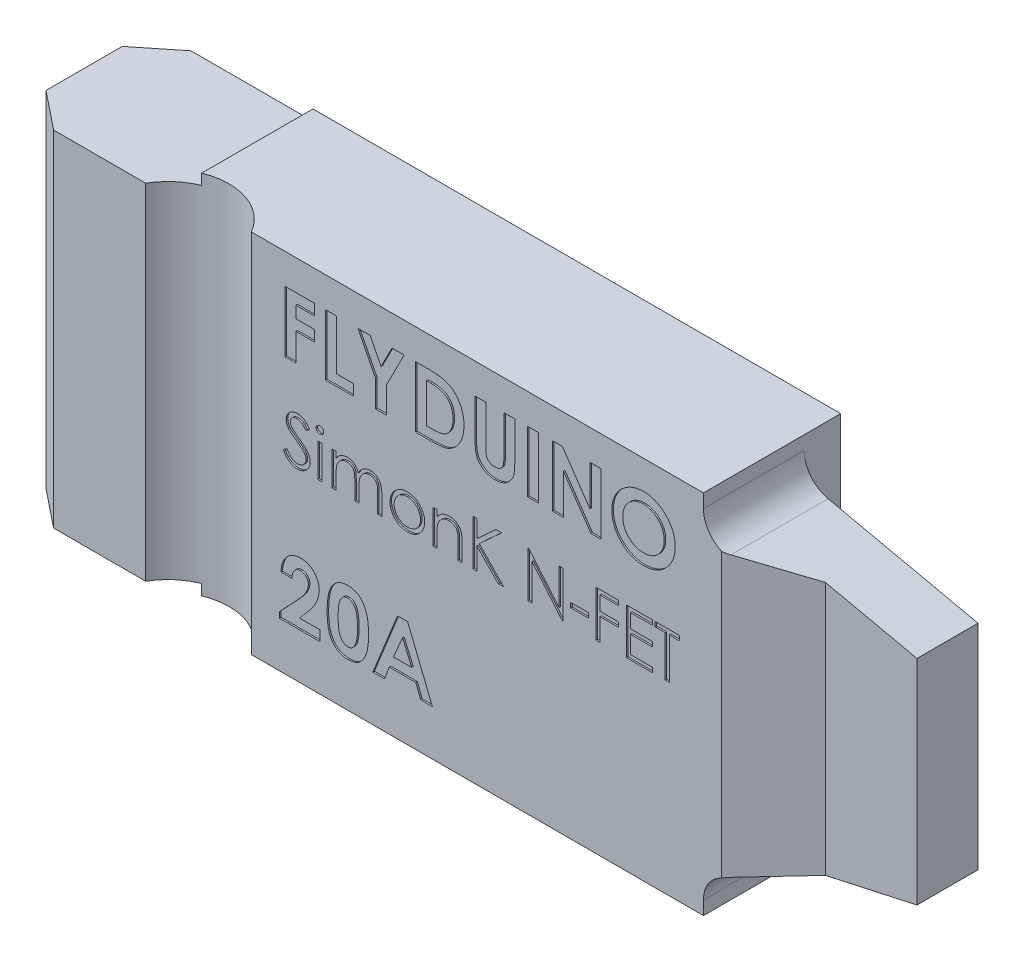
from build123d import *

# Parameters (mm, degrees)
BOSS_EXTRUDE1_DEPTH = 9
SKETCH18_W          = 11.4
SKETCH18_H          = 2.4
CUT_EXTRUDE2_DEPTH  = 100
SKETCH26_W          = 0.717948718
SKETCH26_H          = 4
CUT_EXTRUDE3_DEPTH  = 0.1
SKETCH27_W          = 0.26923077
SKETCH27_H          = 2.192307692
SKETCH27_W_2        = 1.153846154
SKETCH27_H_2        = 0.307692308
CUT_EXTRUDE4_DEPTH  = 0.1


with BuildPart() as part:
    # Sketch1 → Boss-Extrude1 (new body)
    with BuildSketch(Plane.XY):
        with BuildLine():
            Line((-17.3, 12), (17.3, 12))
            Line((17.3, 12), (17.3, 11.108930525))
            ThreePointArc((17.3, 11.108930525), (17.741662479, 9.855302122), (18.871584172, 9.155354348))
            Line((18.871584172, 9.155354348), (28.7, 7))
            Line((28.7, 7), (28.7, -7))
            Line((28.7, -7), (18.871584172, -9.155354348))
            ThreePointArc((18.871584172, -9.155354348), (17.741662479, -9.855302122), (17.3, -11.108930525))
            Line((17.3, -11.108930525), (17.3, -12))
            Line((17.3, -12), (-17.3, -12))
            Line((-17.3, -12), (-17.3, -11.3))
            Line((-17.3, -11.3), (-27.8, -11.3))
            Line((-27.8, -11.3), (-27.8, 11.3))
            Line((-27.8, 11.3), (-17.3, 11.3))
            Line((-17.3, 11.3), (-17.3, 12))
        make_face()
    extrude(amount=BOSS_EXTRUDE1_DEPTH)

    # Sketch18 → Cut-Extrude2 (cut, symmetric)
    with BuildSketch(Plane(origin=(0, 0, 0), x_dir=(1, 0, 0), z_dir=(0, 1, 0))):
        with Locations((23, -1.2)):
            Rectangle(SKETCH18_W, SKETCH18_H)
        Polygon((28.7, -6.4), (22.7, -6.4), (18.5, -9), (28.7, -9), align=None)
        with BuildLine():
            Line((-19.264101615, -9), (-12.335898385, -9))
            ThreePointArc((-12.335898385, -9), (-15.8, -7), (-19.264101615, -9))
        make_face()
        Polygon((-27.8, -7), (-25.3, -9), (-27.8, -9), align=None)
        Polygon((-27.8, -2), (-25.3, 0), (-27.8, 0), align=None)
    extrude(amount=CUT_EXTRUDE2_DEPTH, both=True, mode=Mode.SUBTRACT)

    # Sketch26 → Cut-Extrude3 (cut)
    # profile 1 of 11: a face of its own
    with BuildSketch(Plane.XY.offset(9)):
        Polygon((-10.141536209, 10.015810278), (-8.192818261, 10.015810278), (-8.192818261, 9.29786156), (-9.423587492, 9.29786156), (-9.423587492, 8.528630791), (-8.192818261, 8.528630791), (-8.192818261, 7.810682073), (-9.423587492, 7.810682073), (-9.423587492, 6.015810278), (-10.141536209, 6.015810278), align=None)
    # profile 2 of 11: a face of its own
    with BuildSketch(Plane.XY.offset(9)):
        Polygon((-7.474869543, 10.015810278), (-6.756920825, 10.015810278), (-6.756920825, 6.733758996), (-5.628715697, 6.733758996), (-5.628715697, 6.015810278), (-7.474869543, 6.015810278), align=None)
    # profile 3 of 11: a face of its own
    with BuildSketch(Plane.XY.offset(9)):
        Polygon((-5.346664415, 10.015810278), (-4.547786209, 10.015810278), (-3.833843902, 8.612765407), (-3.119901594, 10.015810278), (-2.321023389, 10.015810278), (-3.474869543, 7.748182073), (-3.474869543, 6.015810278), (-4.192818261, 6.015810278), (-4.192818261, 7.748182073), align=None)
    # profile 4 of 11: a face of its own
    with BuildSketch(Plane.XY.offset(9)):
        with BuildLine():
            Line((-1.577433645, 10.015810278), (-0.672786209, 10.015810278))
            add(Edge.make_bspline(
                [(-0.672786209, 10.015810278), (-0.602258537, 10.015317266), (-0.465927747, 10.014364267), (-0.268411405, 10.003626261), (-0.084746341, 9.987111971), (0.085185839, 9.964393572), (0.241036747, 9.93433091), (0.382605415, 9.896623191), (0.510366982, 9.853095903), (0.625722327, 9.801877216), (0.731030662, 9.742161314), (0.831024287, 9.675642593), (0.925506867, 9.599884278), (1.015804316, 9.516347899), (1.100751325, 9.423505182), (1.181762567, 9.32289394), (1.256854518, 9.21305517), (1.328297048, 9.09662246), (1.392907309, 8.97310238), (1.449262792, 8.843546306), (1.496472123, 8.70878798), (1.534832149, 8.568683785), (1.565409517, 8.423698823), (1.586803885, 8.27354053), (1.600030096, 8.118347926), (1.601371785, 8.013166279), (1.602053534, 7.959720535)],
                knots=[0, 0, 0, 0, 1.44355588, 2.790409838, 4.047694926, 5.217575253, 6.298404546, 7.294384826, 8.214239204, 9.058592145, 9.873746385, 10.689560431, 11.514393297, 12.350027578, 13.205127629, 14.088021785, 14.991911688, 15.926770944, 16.882954281, 17.842803888, 18.816321264, 19.80318086, 20.814351908, 21.847355356, 22.906180909, 24, 24, 24, 24], degree=3))
            add(Edge.make_bspline(
                [(1.602053534, 7.959720535), (1.600268346, 7.884305111), (1.596754098, 7.735845436), (1.567152037, 7.517982572), (1.51927548, 7.309139289), (1.451956694, 7.110949237), (1.368499419, 6.92517733), (1.26880036, 6.755099578), (1.154321335, 6.60162887), (1.026396033, 6.465529366), (0.887884087, 6.348549997), (0.743942243, 6.248365729), (0.593168247, 6.169362073), (0.460315286, 6.119261942), (0.345115193, 6.088103994), (0.243970759, 6.069689347), (0.129081001, 6.052802005), (-0.000625327, 6.039751831), (-0.144579231, 6.028114282), (-0.303354515, 6.021790891), (-0.476437108, 6.016537092), (-0.596659334, 6.016058898), (-0.659164415, 6.015810278)],
                knots=[0, 0, 0, 0, 1.315458931, 2.589557908, 3.828601765, 5.048913369, 6.235739168, 7.376350998, 8.481830359, 9.569842114, 10.627874879, 11.640079404, 12.624025415, 13.590060155, 14.111227486, 14.704434459, 15.382649715, 16.137166398, 16.978595427, 17.902333227, 18.909396075, 20, 20, 20, 20], degree=3))
            Line((-0.659164415, 6.015810278), (-1.577433645, 6.015810278))
            Line((-1.577433645, 6.015810278), (-1.577433645, 10.015810278))
        make_face()
        with BuildLine():
            Line((-0.859484927, 9.29786156), (-0.859484927, 6.733758996))
            Line((-0.859484927, 6.733758996), (-0.484484927, 6.733758996))
            add(Edge.make_bspline(
                [(-0.484484927, 6.733758996), (-0.439865687, 6.733840757), (-0.354048032, 6.733998011), (-0.230146766, 6.741488129), (-0.11556951, 6.749006143), (-0.01063167, 6.763275584), (0.085430459, 6.779170737), (0.171297236, 6.80129102), (0.248738748, 6.824526502), (0.316809061, 6.854108152), (0.379155922, 6.887404267), (0.436881994, 6.926414526), (0.492603815, 6.969733948), (0.545279621, 7.018636617), (0.595108778, 7.072474972), (0.641796464, 7.131526416), (0.685965837, 7.195610783), (0.726483152, 7.265066903), (0.763508092, 7.339161302), (0.796353362, 7.41717627), (0.823586938, 7.499761502), (0.846221819, 7.586143901), (0.862397008, 7.677075524), (0.875778892, 7.771882853), (0.882677643, 7.870941508), (0.883624453, 7.938344327), (0.884104816, 7.972541048)],
                knots=[0, 0, 0, 0, 1.50275155, 2.890291501, 4.180787663, 5.369391935, 6.45668281, 7.458360028, 8.354766181, 9.177074746, 9.954075863, 10.732690366, 11.5210699, 12.329727389, 13.151100085, 13.990027547, 14.863562427, 15.770965086, 16.696477834, 17.652329173, 18.619756807, 19.62365428, 20.657822005, 21.729286259, 22.847956731, 24, 24, 24, 24], degree=3))
            add(Edge.make_bspline(
                [(0.884104816, 7.972541048), (0.883148096, 8.02494429), (0.881282567, 8.127126551), (0.863291802, 8.275957246), (0.834006269, 8.41610364), (0.792218635, 8.547045614), (0.739544027, 8.669151183), (0.673609477, 8.781385854), (0.597252553, 8.885635016), (0.536871581, 8.946790919), (0.50670097, 8.97734874)],
                knots=[0, 0, 0, 0, 1.13821349, 2.219428113, 3.251817212, 4.244760574, 5.201143372, 6.134805572, 7.068016741, 8, 8, 8, 8], degree=3))
            add(Edge.make_bspline(
                [(0.50670097, 8.97734874), (0.476949891, 9.003388135), (0.416186681, 9.05657065), (0.309506452, 9.120296904), (0.191950364, 9.176286664), (0.060829087, 9.220680299), (-0.08259015, 9.255788679), (-0.239161555, 9.28000207), (-0.408046654, 9.295561338), (-0.525046316, 9.297078393), (-0.585446466, 9.29786156)],
                knots=[0, 0, 0, 0, 0.813307809, 1.661089106, 2.549956539, 3.493439533, 4.508053171, 5.589449661, 6.755572447, 8, 8, 8, 8], degree=3))
            Line((-0.585446466, 9.29786156), (-0.859484927, 9.29786156))
        make_face(mode=Mode.SUBTRACT)
    # profile 5 of 11: a face of its own
    with BuildSketch(Plane.XY.offset(9)):
        with BuildLine():
            Line((2.320002252, 10.015810278), (3.03795097, 10.015810278))
            Line((3.03795097, 10.015810278), (3.03795097, 7.413246176))
            add(Edge.make_bspline(
                [(3.03795097, 7.413246176), (3.037990008, 7.38626392), (3.038065411, 7.334147972), (3.041840098, 7.259378649), (3.045294198, 7.190649986), (3.051526373, 7.128037227), (3.060733433, 7.071513587), (3.06964887, 7.020715979), (3.081715034, 6.976553878), (3.099848548, 6.926285844), (3.127786341, 6.869806962), (3.173435145, 6.810943376), (3.226109959, 6.75722181), (3.289243758, 6.712506014), (3.360200565, 6.676334965), (3.438590503, 6.649536221), (3.524303071, 6.634639677), (3.58356861, 6.632365447), (3.614072765, 6.631194894)],
                knots=[0, 0, 0, 0, 1.155499968, 2.231836252, 3.205919964, 4.102923608, 4.924856345, 5.658536265, 6.31071849, 6.882491295, 7.94666036, 8.992281882, 10.060072772, 11.158554251, 12.289267114, 13.461410017, 14.693379945, 16, 16, 16, 16], degree=3))
            add(Edge.make_bspline(
                [(3.614072765, 6.631194894), (3.646479665, 6.632140551), (3.709667634, 6.633984421), (3.800553467, 6.652084007), (3.884759707, 6.680904747), (3.960503421, 6.722039288), (4.02770923, 6.771346245), (4.08459754, 6.827571627), (4.129493585, 6.890827575), (4.158755157, 6.949186005), (4.175184088, 7.002899857), (4.187498391, 7.050891146), (4.196526137, 7.107516116), (4.204716405, 7.171890447), (4.209638125, 7.244680933), (4.214974928, 7.325302182), (4.216930916, 7.414305828), (4.2172643, 7.476280737), (4.217438149, 7.50859874)],
                knots=[0, 0, 0, 0, 1.261321664, 2.459363699, 3.594844139, 4.716940403, 5.803436589, 6.833651888, 7.818396249, 8.814403945, 9.360733334, 10.004355033, 10.743453831, 11.592799886, 12.532235708, 13.585170094, 14.740740724, 16, 16, 16, 16], degree=3))
            Line((4.217438149, 7.50859874), (4.217438149, 10.015810278))
            Line((4.217438149, 10.015810278), (4.935386867, 10.015810278))
            Line((4.935386867, 10.015810278), (4.935386867, 7.62959233))
            add(Edge.make_bspline(
                [(4.935386867, 7.62959233), (4.935287167, 7.581247668), (4.935095453, 7.488285599), (4.932151307, 7.354692563), (4.925883752, 7.232676754), (4.920619729, 7.12220252), (4.910432042, 7.023418686), (4.899818862, 6.935903419), (4.88629145, 6.859966852), (4.866163475, 6.773522299), (4.83142855, 6.673984561), (4.775431296, 6.559371172), (4.704346406, 6.447157721), (4.620327619, 6.338578634), (4.525462723, 6.237712162), (4.421855076, 6.149164455), (4.311150746, 6.074262644), (4.192192952, 6.014838167), (4.065082932, 5.968491555), (3.928563029, 5.937348966), (3.782726338, 5.916308642), (3.68199418, 5.91428746), (3.630098406, 5.913246176)],
                knots=[0, 0, 0, 0, 1.170808336, 2.251350247, 3.235597562, 4.129743112, 4.929140599, 5.639994148, 6.264258765, 6.79612947, 7.788252245, 8.809469599, 9.879094798, 10.999557536, 12.129761673, 13.226370002, 14.293821979, 15.358369427, 16.438775801, 17.562147481, 18.744053101, 20, 20, 20, 20], degree=3))
            add(Edge.make_bspline(
                [(3.630098406, 5.913246176), (3.595617821, 5.913826956), (3.527588336, 5.914972823), (3.427539042, 5.925076375), (3.330821747, 5.939965212), (3.23761818, 5.961686492), (3.147604851, 5.989746329), (3.060805672, 6.024286034), (2.977543212, 6.06511295), (2.898283394, 6.111851556), (2.823123756, 6.162391313), (2.754431726, 6.21841676), (2.68984345, 6.275784606), (2.631224858, 6.336909131), (2.57813567, 6.401148633), (2.530685225, 6.4686487), (2.488944018, 6.539403336), (2.451862072, 6.614687889), (2.420123545, 6.698328802), (2.393366774, 6.793301215), (2.36999143, 6.901093727), (2.352620253, 7.021949188), (2.336871442, 7.155469272), (2.326903313, 7.30200182), (2.321688536, 7.461551036), (2.32057855, 7.572163199), (2.320002252, 7.62959233)],
                knots=[0, 0, 0, 0, 1.001158378, 1.975264943, 2.917723546, 3.841610987, 4.75185031, 5.653588123, 6.552117133, 7.442167995, 8.324307438, 9.179605724, 10.014504199, 10.831958861, 11.636465792, 12.43274043, 13.225645099, 14.020104002, 14.867201867, 15.819789774, 16.883317127, 18.068162734, 19.364263498, 20.787406516, 22.332041935, 24, 24, 24, 24], degree=3))
            Line((2.320002252, 7.62959233), (2.320002252, 10.015810278))
        make_face()
    # profile 6 of 11: a face of its own
    with BuildSketch(Plane.XY.offset(9)):
        with Locations((6.114874047, 8.015810278)):
            Rectangle(SKETCH26_W, SKETCH26_H)
    # profile 7 of 11: a face of its own
    with BuildSketch(Plane.XY.offset(9)):
        Polygon((7.396925329, 10.015810278), (8.043559944, 10.015810278), (9.858463791, 7.38359874), (9.858463791, 10.015810278), (10.576412508, 10.015810278), (10.576412508, 6.015810278), (9.924970201, 6.015810278), (8.114874047, 8.640008996), (8.114874047, 6.015810278), (7.396925329, 6.015810278), align=None)
    # profile 8 of 11: a face of its own
    with BuildSketch(Plane.XY.offset(9)):
        with BuildLine():
            add(Edge.make_bspline(
                [(13.379297124, 10.118374381), (13.448842026, 10.116573739), (13.586139415, 10.113018864), (13.788054328, 10.083386204), (13.982636681, 10.035104033), (14.169798484, 9.967988323), (14.349071105, 9.88022124), (14.521086899, 9.774291038), (14.685229714, 9.648198348), (14.839817545, 9.504884705), (14.982684582, 9.349037375), (15.106478952, 9.181240017), (15.21204625, 9.005840429), (15.299540709, 8.822368623), (15.366184025, 8.629553968), (15.412950396, 8.428379565), (15.442995472, 8.218902647), (15.446451118, 8.076277417), (15.44820738, 8.003791048)],
                knots=[0, 0, 0, 0, 1.014329547, 2.002516266, 2.970391464, 3.935626869, 4.897733899, 5.877609409, 6.878433252, 7.912639331, 8.949961323, 9.958554974, 10.949718813, 11.932905612, 12.9188844, 13.919928257, 14.942845884, 16, 16, 16, 16], degree=3))
            add(Edge.make_bspline(
                [(15.44820738, 8.003791048), (15.446337037, 7.932121432), (15.442651467, 7.790894156), (15.414176967, 7.583347649), (15.366623045, 7.384328243), (15.301110052, 7.193385453), (15.215202412, 7.01144414), (15.111693791, 6.837342635), (14.987852795, 6.67269664), (14.848196389, 6.517594511), (14.694446807, 6.376806048), (14.531601592, 6.252736458), (14.360412663, 6.147604569), (14.181130585, 6.061458538), (13.993370898, 5.994603775), (13.79759739, 5.947432882), (13.593822175, 5.918766178), (13.455245148, 5.915104682), (13.384906098, 5.913246176)],
                knots=[0, 0, 0, 0, 1.051557043, 2.072126891, 3.067553643, 4.050577992, 5.02905126, 6.015227836, 7.017913613, 8.04756643, 9.074058332, 10.072836633, 11.047628519, 12.017157415, 12.98668631, 13.966869689, 14.968021931, 16, 16, 16, 16], degree=3))
            add(Edge.make_bspline(
                [(13.384906098, 5.913246176), (13.311339886, 5.914913347), (13.166792336, 5.918189111), (12.955246349, 5.949340127), (12.752567014, 5.99626444), (12.560456955, 6.066296459), (12.376959694, 6.153842371), (12.20342344, 6.261660412), (12.039906513, 6.389572402), (11.887346872, 6.534302468), (11.749127469, 6.692668905), (11.627121733, 6.859969001), (11.524207188, 7.034924732), (11.440380069, 7.21761798), (11.374294136, 7.406913352), (11.327678019, 7.60396371), (11.300140766, 7.808296456), (11.296304987, 7.947083342), (11.294361226, 8.017412842)],
                knots=[0, 0, 0, 0, 1.067978421, 2.098431617, 3.099715153, 4.085208694, 5.062210972, 6.048429807, 7.046490867, 8.072918869, 9.098532598, 10.095778865, 11.076610158, 12.041847152, 13.011192615, 13.984257998, 14.978533688, 16, 16, 16, 16], degree=3))
            add(Edge.make_bspline(
                [(11.294361226, 8.017412842), (11.29497129, 8.064726849), (11.296183694, 8.158755758), (11.310788367, 8.298101801), (11.331814897, 8.434727996), (11.362912138, 8.568089613), (11.400687338, 8.699127456), (11.449630445, 8.826621792), (11.505340946, 8.951934612), (11.570433421, 9.073585813), (11.64280996, 9.190456104), (11.721779207, 9.301994186), (11.80753973, 9.406851402), (11.899815267, 9.50571683), (11.99892381, 9.597940619), (12.10356169, 9.684828327), (12.215758271, 9.764071907), (12.333057924, 9.837606644), (12.454799339, 9.904102832), (12.580486918, 9.960702399), (12.707531249, 10.010129836), (12.837629473, 10.049140155), (12.969387357, 10.080913652), (13.104212465, 10.10192601), (13.24088673, 10.116530279), (13.333050834, 10.117758222), (13.379297124, 10.118374381)],
                knots=[0, 0, 0, 0, 1.034744296, 2.056386356, 3.06226378, 4.057406941, 5.050368692, 6.043467995, 7.042652155, 8.049140477, 9.059438543, 10.048523776, 11.036952808, 12.020949711, 13.004946614, 13.997082645, 14.994316842, 16.007702937, 17.024872941, 18.026463647, 19.021641123, 20.005082605, 20.995858141, 21.984425357, 22.988620895, 24, 24, 24, 24], degree=3))
        make_face()
        with BuildLine():
            add(Edge.make_bspline(
                [(13.368079175, 9.400425663), (13.321275465, 9.399169814), (13.228903671, 9.396691272), (13.093411071, 9.377808129), (12.96333339, 9.347649604), (12.8393917, 9.303965349), (12.721048827, 9.248366379), (12.608094986, 9.181046964), (12.502094354, 9.099693075), (12.401633515, 9.008672239), (12.310883678, 8.907254109), (12.230703334, 8.798567336), (12.1636053, 8.682793423), (12.107410277, 8.561007883), (12.065107879, 8.43184127), (12.034977149, 8.296305361), (12.015935653, 8.154166619), (12.013535448, 8.057270824), (12.012309944, 8.007797458)],
                knots=[0, 0, 0, 0, 1.033739768, 2.040188636, 3.016340934, 3.979330865, 4.937572243, 5.900995986, 6.878200029, 7.884839167, 8.891893314, 9.879764717, 10.863503415, 11.843163062, 12.837761627, 13.859916423, 14.907309254, 16, 16, 16, 16], degree=3))
            add(Edge.make_bspline(
                [(12.012309944, 8.007797458), (12.013934776, 7.952969839), (12.017119176, 7.845516791), (12.039525001, 7.688767179), (12.077859138, 7.540732729), (12.133212887, 7.402137453), (12.201866058, 7.271442356), (12.2871224, 7.150249291), (12.387601164, 7.037832612), (12.46500919, 6.972199072), (12.504297124, 6.938887201)],
                knots=[0, 0, 0, 0, 1.078454662, 2.113592447, 3.107694534, 4.079536787, 5.043276885, 6.005368276, 6.987637804, 8, 8, 8, 8], degree=3))
            add(Edge.make_bspline(
                [(12.504297124, 6.938887201), (12.536481442, 6.914277671), (12.600124961, 6.865613066), (12.701713872, 6.803239392), (12.806330448, 6.749778931), (12.91476415, 6.706583511), (13.026785972, 6.67260672), (13.142380554, 6.648813331), (13.261384106, 6.633880922), (13.341859885, 6.632096217), (13.382502252, 6.631194894)],
                knots=[0, 0, 0, 0, 1.023928204, 2.024787132, 3.009472467, 3.9914905, 4.972207045, 5.96565515, 6.972602802, 8, 8, 8, 8], degree=3))
            add(Edge.make_bspline(
                [(13.382502252, 6.631194894), (13.428501171, 6.632461391), (13.519005491, 6.634953263), (13.651975823, 6.653603944), (13.77936544, 6.685167629), (13.901965187, 6.728468671), (14.019421541, 6.784765734), (14.131160462, 6.854173185), (14.237377857, 6.935838792), (14.33771071, 7.028054931), (14.429419681, 7.129872578), (14.509432705, 7.239139076), (14.578664121, 7.353446957), (14.633690568, 7.474414075), (14.677664238, 7.600898558), (14.707432329, 7.733460578), (14.726634683, 7.871553665), (14.729035563, 7.96553089), (14.730258662, 8.013406432)],
                knots=[0, 0, 0, 0, 1.026359118, 2.019393844, 2.989460624, 3.950973911, 4.916101784, 5.890408035, 6.881132271, 7.902007068, 8.92769091, 9.933912415, 10.920395702, 11.90457117, 12.894218921, 13.903490204, 14.931958862, 16, 16, 16, 16], degree=3))
            add(Edge.make_bspline(
                [(14.730258662, 8.013406432), (14.728993244, 8.061006677), (14.726502461, 8.154700498), (14.707818953, 8.292438549), (14.676455436, 8.424415346), (14.633024367, 8.550846424), (14.57756519, 8.671855731), (14.508984292, 8.787017726), (14.427522315, 8.896221077), (14.335054101, 8.998721604), (14.234408132, 9.092913023), (14.126354629, 9.174654052), (14.013917049, 9.245684408), (13.894515525, 9.30132672), (13.770592913, 9.345656832), (13.641393031, 9.378302163), (13.506426525, 9.396558617), (13.414606021, 9.399125158), (13.368079175, 9.400425663)],
                knots=[0, 0, 0, 0, 1.055025985, 2.07665775, 3.074803781, 4.057872707, 5.035505728, 6.020516407, 7.023567878, 8.050795229, 9.077271434, 10.074415901, 11.050397877, 12.019801805, 12.988065821, 13.964604439, 14.968634123, 16, 16, 16, 16], degree=3))
        make_face(mode=Mode.SUBTRACT)
    # profile 9 of 11: a face of its own
    with BuildSketch(Plane.XY.offset(9)):
        with BuildLine():
            Line((-9.679997748, -6.343164081), (-10.397946466, -6.343164081))
            add(Edge.make_bspline(
                [(-10.397946466, -6.343164081), (-10.394845756, -6.288855058), (-10.388787154, -6.18273849), (-10.364687566, -6.028600776), (-10.332394946, -5.882957585), (-10.289296158, -5.746318395), (-10.235139711, -5.618732855), (-10.171319189, -5.499766018), (-10.096204124, -5.390044248), (-10.011393211, -5.290096686), (-9.918326305, -5.200432806), (-9.818935569, -5.120931176), (-9.711700685, -5.055328432), (-9.598580923, -5.001343448), (-9.479595546, -4.958211954), (-9.353618764, -4.92937506), (-9.221741353, -4.909846433), (-9.131460586, -4.908137599), (-9.085446466, -4.907266645)],
                knots=[0, 0, 0, 0, 1.199038563, 2.342849363, 3.436047546, 4.486744587, 5.497670872, 6.488682221, 7.459191391, 8.424610317, 9.374430501, 10.305433194, 11.225809216, 12.140057399, 13.06607119, 14.010487599, 14.985989317, 16, 16, 16, 16], degree=3))
            add(Edge.make_bspline(
                [(-9.085446466, -4.907266645), (-9.028964786, -4.909029022), (-8.918699312, -4.912469595), (-8.758474831, -4.941818829), (-8.608842684, -4.990909958), (-8.46991164, -5.059503212), (-8.342864443, -5.14664375), (-8.227722161, -5.25054458), (-8.12796688, -5.373385596), (-8.042966123, -5.510055584), (-7.972340652, -5.654769867), (-7.922849264, -5.804410436), (-7.890319108, -5.955006438), (-7.886849565, -6.056410164), (-7.885125953, -6.106785875)],
                knots=[0, 0, 0, 0, 1.075374347, 2.099382735, 3.09057751, 4.06680945, 5.040638231, 6.016817125, 7.011024321, 8.044445721, 9.0776792, 10.070479129, 11.0414456, 12, 12, 12, 12], degree=3))
            add(Edge.make_bspline(
                [(-7.885125953, -6.106785875), (-7.885797037, -6.137256666), (-7.887147762, -6.198586841), (-7.896539534, -6.291394449), (-7.910629048, -6.385929848), (-7.931872602, -6.482111983), (-7.958365056, -6.579967816), (-7.990504231, -6.679790194), (-8.029035627, -6.781013163), (-8.073316234, -6.884775969), (-8.126143111, -6.991415489), (-8.187652666, -7.102530291), (-8.259477502, -7.218021808), (-8.340750066, -7.338542143), (-8.43186508, -7.463901216), (-8.533267335, -7.593721406), (-8.643788918, -7.728460159), (-8.722229194, -7.818525454), (-8.762529799, -7.864798696)],
                knots=[0, 0, 0, 0, 0.728284026, 1.46585585, 2.227944881, 3.01186502, 3.81876927, 4.650621989, 5.517437689, 6.406905708, 7.346299482, 8.360816762, 9.441613733, 10.596154504, 11.834900912, 13.145207542, 14.533280747, 16, 16, 16, 16], degree=3))
            Line((-8.762529799, -7.864798696), (-9.179997748, -8.343164081))
            Line((-9.179997748, -8.343164081), (-7.833843902, -8.343164081))
            Line((-7.833843902, -8.343164081), (-7.833843902, -9.009830747))
            Line((-7.833843902, -9.009830747), (-10.500510568, -9.009830747))
            Line((-10.500510568, -9.009830747), (-10.500510568, -8.646048696))
            Line((-10.500510568, -8.646048696), (-9.316215697, -7.385632029))
            add(Edge.make_bspline(
                [(-9.316215697, -7.385632029), (-9.281927317, -7.348865284), (-9.215520893, -7.277659001), (-9.121031396, -7.173084999), (-9.035526748, -7.073846768), (-8.960779957, -6.97888762), (-8.892868408, -6.891287643), (-8.834820272, -6.808406465), (-8.786104454, -6.730993362), (-8.733216523, -6.63764668), (-8.682990375, -6.526314151), (-8.636904844, -6.398054512), (-8.608812524, -6.275467837), (-8.604934895, -6.195587724), (-8.603074671, -6.157266645)],
                knots=[0, 0, 0, 0, 1.246127091, 2.413378631, 3.493388633, 4.492180848, 5.408488754, 6.240484944, 6.999099869, 7.674939598, 8.898438119, 10.020720584, 11.050475521, 12, 12, 12, 12], degree=3))
            add(Edge.make_bspline(
                [(-8.603074671, -6.157266645), (-8.604465516, -6.120193957), (-8.6071605, -6.048359682), (-8.636776195, -5.946175807), (-8.682657857, -5.85365874), (-8.747311599, -5.773572994), (-8.82562753, -5.707761227), (-8.916128944, -5.658812283), (-9.01807799, -5.630568967), (-9.089546213, -5.627033912), (-9.126311851, -5.625215363)],
                knots=[0, 0, 0, 0, 1.062038974, 2.057870785, 3.028805853, 4.01125022, 4.991535629, 5.949134679, 6.94496649, 8, 8, 8, 8], degree=3))
            add(Edge.make_bspline(
                [(-9.126311851, -5.625215363), (-9.145305447, -5.625887157), (-9.182697392, -5.627209691), (-9.237660629, -5.636013446), (-9.289962097, -5.651529144), (-9.340183942, -5.672317995), (-9.387790182, -5.699873767), (-9.432660739, -5.733840646), (-9.475268383, -5.773355457), (-9.515417696, -5.818294642), (-9.551958812, -5.868446785), (-9.584414498, -5.92335385), (-9.611249947, -5.982981753), (-9.634876851, -6.046543316), (-9.653099051, -6.114721242), (-9.666367073, -6.187107493), (-9.676453864, -6.263584306), (-9.678794963, -6.316154923), (-9.679997748, -6.343164081)],
                knots=[0, 0, 0, 0, 0.903469896, 1.778625579, 2.63899355, 3.493148037, 4.358286772, 5.247621495, 6.164656832, 7.118446693, 8.109501108, 9.111810964, 10.146451449, 11.215617525, 12.33435995, 13.498009769, 14.714554818, 16, 16, 16, 16], degree=3))
        make_face()
    # profile 10 of 11: a face of its own
    with BuildSketch(Plane.XY.offset(9)):
        with BuildLine():
            add(Edge.make_bspline(
                [(-6.025350312, -4.907266645), (-5.990598614, -4.907782543), (-5.922267491, -4.908796938), (-5.82162861, -4.91978366), (-5.724685542, -4.936381532), (-5.631059034, -4.959529777), (-5.54142302, -4.990165653), (-5.45512511, -5.026836272), (-5.373192499, -5.071465084), (-5.294580285, -5.121875618), (-5.219318748, -5.17894749), (-5.149216747, -5.24401237), (-5.082994071, -5.315573113), (-5.022084197, -5.394711589), (-4.965138257, -5.480707951), (-4.912343366, -5.573575833), (-4.864103682, -5.673769763), (-4.819878553, -5.781470548), (-4.780332303, -5.898292577), (-4.747022545, -6.025575848), (-4.718453855, -6.16334943), (-4.694339864, -6.31195626), (-4.676113584, -6.471593875), (-4.663828705, -6.642156217), (-4.655398239, -6.823314468), (-4.654710203, -6.94758754), (-4.654356722, -7.011433311)],
                knots=[0, 0, 0, 0, 0.879237366, 1.728815576, 2.559023295, 3.367336655, 4.166867292, 4.954216142, 5.737608147, 6.525189134, 7.316157332, 8.124696809, 8.942788509, 9.781158001, 10.649253743, 11.551476218, 12.482711956, 13.461909668, 14.496590415, 15.601789533, 16.789733467, 18.056700938, 19.410929216, 20.8549011, 22.384193279, 24, 24, 24, 24], degree=3))
            add(Edge.make_bspline(
                [(-4.654356722, -7.011433311), (-4.65473874, -7.076077865), (-4.655480993, -7.201681073), (-4.663478248, -7.38449629), (-4.677249899, -7.556297017), (-4.694999796, -7.717065481), (-4.719312301, -7.866716782), (-4.747785623, -8.005638417), (-4.781621165, -8.13378003), (-4.822470056, -8.25085289), (-4.866427489, -8.358742822), (-4.91479913, -8.458741397), (-4.966741866, -8.551119469), (-5.02106429, -8.637270685), (-5.080744554, -8.714655351), (-5.142877853, -8.785904952), (-5.210169582, -8.848305498), (-5.279786498, -8.905072833), (-5.354278951, -8.954131202), (-5.43287872, -8.997036844), (-5.516987102, -9.031838415), (-5.605070944, -9.062106962), (-5.698631653, -9.083836514), (-5.796182563, -9.101078198), (-5.898825004, -9.110607011), (-5.968708112, -9.111789123), (-6.004516979, -9.11239485)],
                knots=[0, 0, 0, 0, 1.643780988, 3.193836972, 4.651895693, 6.025988579, 7.305620092, 8.505800249, 9.631074763, 10.672816429, 11.65661981, 12.592235626, 13.49536222, 14.350718032, 15.179365177, 15.97804903, 16.751647189, 17.51006938, 18.259804725, 19.016521909, 19.783502495, 20.571750527, 21.382245291, 22.22305063, 23.089471752, 24, 24, 24, 24], degree=3))
            add(Edge.make_bspline(
                [(-6.004516979, -9.11239485), (-6.040324879, -9.111777439), (-6.11047203, -9.110567939), (-6.213392026, -9.101149049), (-6.311459907, -9.083766667), (-6.405760832, -9.061940139), (-6.495638481, -9.031905387), (-6.581523817, -8.996062578), (-6.662756453, -8.953424646), (-6.739561311, -8.904251975), (-6.811676158, -8.847864457), (-6.880221657, -8.784865218), (-6.945046181, -8.715413946), (-7.00516359, -8.63873273), (-7.061558432, -8.555845103), (-7.113642598, -8.465804529), (-7.161384787, -8.368742106), (-7.206278384, -8.264522537), (-7.245285236, -8.150902096), (-7.279999524, -8.026866165), (-7.308436556, -7.891380804), (-7.331307519, -7.744489539), (-7.349567683, -7.586503565), (-7.363151147, -7.417346626), (-7.371192823, -7.236939934), (-7.371927292, -7.112937428), (-7.37230544, -7.049093568)],
                knots=[0, 0, 0, 0, 0.917216111, 1.796812873, 2.643793957, 3.46689424, 4.273913431, 5.068098542, 5.848489301, 6.620921603, 7.401012384, 8.190319798, 9.003608147, 9.831726257, 10.68377682, 11.569763213, 12.493818149, 13.453288342, 14.474581811, 15.568529029, 16.750744269, 18.018426408, 19.375425659, 20.823733699, 22.36466933, 24, 24, 24, 24], degree=3))
            add(Edge.make_bspline(
                [(-7.37230544, -7.049093568), (-7.37162046, -6.96038755), (-7.370298781, -6.789228147), (-7.353549501, -6.541952574), (-7.328965805, -6.31338914), (-7.29285818, -6.103920178), (-7.248211601, -5.912769873), (-7.191039331, -5.741197426), (-7.125952861, -5.586828745), (-7.070490827, -5.495379809), (-7.043779799, -5.451337158)],
                knots=[0, 0, 0, 0, 1.288568992, 2.486310467, 3.599230591, 4.627010532, 5.572937695, 6.447898582, 7.252493626, 8, 8, 8, 8], degree=3))
            add(Edge.make_bspline(
                [(-7.043779799, -5.451337158), (-7.012721488, -5.40806967), (-6.951996371, -5.323473206), (-6.845816805, -5.212413863), (-6.731740687, -5.117430474), (-6.607424956, -5.040672599), (-6.474835719, -4.980141332), (-6.33283463, -4.93738878), (-6.181946073, -4.912479151), (-6.078328385, -4.909030093), (-6.025350312, -4.907266645)],
                knots=[0, 0, 0, 0, 1.058512271, 2.069600068, 3.047294572, 4.004278952, 4.967380941, 5.939006123, 6.946246673, 8, 8, 8, 8], degree=3))
        make_face()
        with BuildLine():
            add(Edge.make_bspline(
                [(-6.007722107, -5.625215363), (-6.03913793, -5.62670441), (-6.100729619, -5.629623734), (-6.190102096, -5.654404673), (-6.274374761, -5.692680169), (-6.338478726, -5.738738744), (-6.386459906, -5.782891412), (-6.419984701, -5.822848141), (-6.452314082, -5.86743697), (-6.480869019, -5.918669965), (-6.507832334, -5.974706263), (-6.53418362, -6.035800236), (-6.555784754, -6.103452483), (-6.577007297, -6.176510879), (-6.595600224, -6.256995293), (-6.611177021, -6.345563598), (-6.62509352, -6.44279176), (-6.634800444, -6.548743465), (-6.64385021, -6.663307861), (-6.650337511, -6.786740152), (-6.653049688, -6.91900704), (-6.653911807, -7.010097283), (-6.654356722, -7.057106388)],
                knots=[0, 0, 0, 0, 1.076674018, 2.110852608, 3.161083442, 4.239746716, 4.804137807, 5.395870207, 6.026861976, 6.692161227, 7.405688833, 8.16177676, 8.973626916, 9.841385931, 10.773283133, 11.807421078, 12.927755683, 14.143907515, 15.458935494, 16.872852025, 18.386167141, 20, 20, 20, 20], degree=3))
            add(Edge.make_bspline(
                [(-6.654356722, -7.057106388), (-6.653624446, -7.118008956), (-6.652220252, -7.234794146), (-6.644865738, -7.402735315), (-6.630124227, -7.555575302), (-6.611788763, -7.69434996), (-6.586035855, -7.818159298), (-6.556405467, -7.928174667), (-6.519814573, -8.022993639), (-6.477526745, -8.103987509), (-6.430691069, -8.172888826), (-6.379848883, -8.231455255), (-6.326731181, -8.28217102), (-6.269679986, -8.323366811), (-6.208831406, -8.354937367), (-6.144693414, -8.377645677), (-6.077225251, -8.39154638), (-6.031023749, -8.39347396), (-6.007722107, -8.394446132)],
                knots=[0, 0, 0, 0, 1.771748488, 3.397459088, 4.888034009, 6.237357457, 7.467047327, 8.564189669, 9.548206622, 10.417051504, 11.216568818, 11.965764335, 12.669334354, 13.348544111, 14.005342236, 14.656555988, 15.322436492, 16, 16, 16, 16], degree=3))
            add(Edge.make_bspline(
                [(-6.007722107, -8.394446132), (-5.985220103, -8.3937809), (-5.941163978, -8.392478458), (-5.87692028, -8.379109069), (-5.816166874, -8.357373345), (-5.759087194, -8.326626638), (-5.705477074, -8.287527497), (-5.655598527, -8.239904101), (-5.609827726, -8.183281758), (-5.58316145, -8.141259605), (-5.569420825, -8.119606388)],
                knots=[0, 0, 0, 0, 0.992283464, 1.942767638, 2.88273346, 3.832339453, 4.79467288, 5.803907806, 6.868395428, 8, 8, 8, 8], degree=3))
            add(Edge.make_bspline(
                [(-5.569420825, -8.119606388), (-5.553243553, -8.09001796), (-5.519321125, -8.027973424), (-5.480066033, -7.923275584), (-5.447023285, -7.805193725), (-5.418583874, -7.673360365), (-5.399133052, -7.527255536), (-5.382382028, -7.367805702), (-5.374302593, -7.194207938), (-5.372988429, -7.073938781), (-5.37230544, -7.011433311)],
                knots=[0, 0, 0, 0, 0.710965849, 1.490837728, 2.352621235, 3.297892224, 4.334225155, 5.461620853, 6.680770821, 8, 8, 8, 8], degree=3))
            add(Edge.make_bspline(
                [(-5.37230544, -7.011433311), (-5.372569264, -6.948385264), (-5.37307708, -6.827028535), (-5.382394025, -6.652806676), (-5.395368582, -6.493683921), (-5.414346615, -6.350015529), (-5.438765304, -6.221452735), (-5.468861429, -6.108003943), (-5.504342523, -6.009445567), (-5.546418871, -5.925875884), (-5.593021041, -5.854853118), (-5.642490667, -5.793921094), (-5.695036927, -5.741898868), (-5.750571947, -5.698590674), (-5.810381103, -5.665499965), (-5.873321963, -5.642135187), (-5.939523561, -5.62800028), (-5.984682422, -5.626156198), (-6.007722107, -5.625215363)],
                knots=[0, 0, 0, 0, 1.793836731, 3.452829483, 4.963243077, 6.335886805, 7.574563692, 8.684454726, 9.672768357, 10.54971625, 11.340229787, 12.085688095, 12.778991901, 13.440269426, 14.083255152, 14.715733572, 15.344777694, 16, 16, 16, 16], degree=3))
        make_face(mode=Mode.SUBTRACT)
    # profile 11 of 11: a face of its own
    with BuildSketch(Plane.XY.offset(9)):
        Polygon((-2.756119543, -5.009830747), (-2.090254158, -5.009830747), (-0.474869543, -9.009830747), (-1.241696466, -9.009830747), (-1.552593902, -8.189317927), (-3.295382363, -8.189317927), (-3.606279799, -9.009830747), (-4.37230544, -9.009830747), align=None)
        Polygon((-2.423587492, -6.082747414), (-3.022946466, -7.471369209), (-1.824228517, -7.471369209), align=None, mode=Mode.SUBTRACT)
    extrude(amount=-CUT_EXTRUDE3_DEPTH, mode=Mode.SUBTRACT)

    # Sketch27 → Cut-Extrude4 (cut)
    # profile 1 of 12: a face of its own
    with BuildSketch(Plane.XY.offset(9)):
        with BuildLine():
            Line((-10.2454675, 0.700170261), (-9.991861731, 0.852213531))
            add(Edge.make_bspline(
                [(-9.991861731, 0.852213531), (-9.96827467, 0.812729772), (-9.923082772, 0.737080414), (-9.847695893, 0.634859237), (-9.769581969, 0.547977388), (-9.688162541, 0.476940296), (-9.603934585, 0.421012679), (-9.516348253, 0.381410766), (-9.425698701, 0.356711359), (-9.364006854, 0.353711284), (-9.333207885, 0.352213531)],
                knots=[0, 0, 0, 0, 1.272034388, 2.437168799, 3.508375237, 4.49857839, 5.41946034, 6.295179144, 7.148887113, 8, 8, 8, 8], degree=3))
            add(Edge.make_bspline(
                [(-9.333207885, 0.352213531), (-9.306904861, 0.352946107), (-9.254759056, 0.354398442), (-9.177991419, 0.368353415), (-9.103435588, 0.389792382), (-9.032628185, 0.420496038), (-8.966546229, 0.457643311), (-8.908597633, 0.502511464), (-8.858500965, 0.552745354), (-8.817521724, 0.60878763), (-8.786081694, 0.669059471), (-8.761917064, 0.730924572), (-8.748507, 0.795354774), (-8.746486926, 0.838735171), (-8.7454675, 0.860626992)],
                knots=[0, 0, 0, 0, 1.095163259, 2.171163733, 3.241058638, 4.321873601, 5.38011039, 6.391990106, 7.366004449, 8.327778327, 9.272591725, 10.192022065, 11.087607919, 12, 12, 12, 12], degree=3))
            add(Edge.make_bspline(
                [(-8.7454675, 0.860626992), (-8.746731195, 0.885604863), (-8.749300102, 0.936381225), (-8.771012799, 1.011295214), (-8.805169296, 1.085431702), (-8.836680134, 1.13128993), (-8.853039615, 1.155098146)],
                knots=[0, 0, 0, 0, 0.938893495, 1.908633276, 2.914225137, 4, 4, 4, 4], degree=3))
            add(Edge.make_bspline(
                [(-8.853039615, 1.155098146), (-8.86647157, 1.172281138), (-8.89467028, 1.208354679), (-8.943148148, 1.262050595), (-9.000033388, 1.317437812), (-9.063379293, 1.376631289), (-9.135493369, 1.436877972), (-9.214116953, 1.501050782), (-9.301257403, 1.566709276), (-9.362371257, 1.610742904), (-9.393905, 1.633463531)],
                knots=[0, 0, 0, 0, 0.722233717, 1.516239348, 2.393582979, 3.351407094, 4.387010283, 5.505090956, 6.712668013, 8, 8, 8, 8], degree=3))
            add(Edge.make_bspline(
                [(-9.393905, 1.633463531), (-9.425468425, 1.655945177), (-9.485815291, 1.698928373), (-9.570208361, 1.762720617), (-9.645675044, 1.821043934), (-9.711879915, 1.874447372), (-9.768793855, 1.922938177), (-9.816865351, 1.966050696), (-9.854869828, 2.004950891), (-9.876003183, 2.030186327), (-9.885491538, 2.041516415)],
                knots=[0, 0, 0, 0, 1.452282411, 2.77665338, 3.964542531, 5.026858415, 5.96415736, 6.766646006, 7.446254459, 8, 8, 8, 8], degree=3))
            add(Edge.make_bspline(
                [(-9.885491538, 2.041516415), (-9.89875372, 2.059174447), (-9.92483558, 2.093901336), (-9.959263585, 2.148179785), (-9.988525724, 2.203742584), (-10.011464866, 2.26073904), (-10.030781625, 2.318368979), (-10.043774137, 2.377384332), (-10.05190962, 2.437520291), (-10.052742752, 2.477989006), (-10.053159808, 2.498247184)],
                knots=[0, 0, 0, 0, 1.068054152, 2.10047183, 3.106115577, 4.101338837, 5.06977816, 6.043150881, 7.020423561, 8, 8, 8, 8], degree=3))
            add(Edge.make_bspline(
                [(-10.053159808, 2.498247184), (-10.052041057, 2.529986991), (-10.049827468, 2.592788189), (-10.031107025, 2.684528901), (-10.00155883, 2.772117258), (-9.960163212, 2.854686116), (-9.906799767, 2.930085528), (-9.845046075, 2.999182802), (-9.771493372, 3.057270159), (-9.690791124, 3.108023351), (-9.60245709, 3.14774843), (-9.509893459, 3.177714985), (-9.412953111, 3.194694348), (-9.347293282, 3.197131004), (-9.313977115, 3.198367377)],
                knots=[0, 0, 0, 0, 1.005424448, 1.989358655, 2.955360095, 3.929531133, 4.905563448, 5.876582895, 6.856512386, 7.866279853, 8.892233794, 9.918561126, 10.94386622, 12, 12, 12, 12], degree=3))
            add(Edge.make_bspline(
                [(-9.313977115, 3.198367377), (-9.278625029, 3.197148047), (-9.208321014, 3.194723189), (-9.1049074, 3.17363959), (-9.005341072, 3.1387533), (-8.925246845, 3.099163022), (-8.862561621, 3.059621809), (-8.814756421, 3.023604816), (-8.766312892, 2.982140438), (-8.716840274, 2.935118227), (-8.667176851, 2.882106726), (-8.616585321, 2.823468992), (-8.564947376, 2.759563373), (-8.531728067, 2.713942372), (-8.514698269, 2.690554877)],
                knots=[0, 0, 0, 0, 1.286793592, 2.559021753, 3.825965368, 5.121522368, 5.803751409, 6.523245864, 7.299691795, 8.125521123, 9.008227632, 9.944561021, 10.946284179, 12, 12, 12, 12], degree=3))
            Line((-8.514698269, 2.690554877), (-8.758087692, 2.506059684))
            add(Edge.make_bspline(
                [(-8.758087692, 2.506059684), (-8.772784206, 2.524992848), (-8.801086255, 2.561453693), (-8.844054386, 2.612514821), (-8.884553227, 2.659157518), (-8.92445357, 2.699670485), (-8.961648111, 2.736272313), (-8.997748433, 2.767609248), (-9.03223502, 2.793988329), (-9.075706658, 2.822139952), (-9.130321845, 2.850045527), (-9.198880019, 2.873659022), (-9.270525397, 2.887849075), (-9.319322224, 2.889725265), (-9.344025192, 2.890675069)],
                knots=[0, 0, 0, 0, 1.181633172, 2.275549214, 3.290209073, 4.226197932, 5.078386478, 5.862611352, 6.581680152, 7.217281963, 8.414376989, 9.595101626, 10.782541182, 12, 12, 12, 12], degree=3))
            add(Edge.make_bspline(
                [(-9.344025192, 2.890675069), (-9.375016497, 2.889636469), (-9.434780309, 2.887633627), (-9.519629083, 2.865759354), (-9.595995304, 2.831317759), (-9.661611789, 2.783047778), (-9.716243483, 2.725858356), (-9.755762448, 2.660047909), (-9.779548303, 2.587377278), (-9.782450829, 2.536684429), (-9.783929038, 2.510867377)],
                knots=[0, 0, 0, 0, 1.14458467, 2.207223713, 3.21896685, 4.227309161, 5.202851033, 6.127160689, 7.046193047, 8, 8, 8, 8], degree=3))
            add(Edge.make_bspline(
                [(-9.783929038, 2.510867377), (-9.783592073, 2.494794681), (-9.78291759, 2.462623007), (-9.773510621, 2.415093217), (-9.761425482, 2.367683497), (-9.742274655, 2.320606998), (-9.715835823, 2.273040404), (-9.681117101, 2.224164629), (-9.637391405, 2.173548879), (-9.603896823, 2.140628273), (-9.586212692, 2.123247184)],
                knots=[0, 0, 0, 0, 0.858281714, 1.717966888, 2.583508476, 3.4729293, 4.427298488, 5.488583878, 6.674047936, 8, 8, 8, 8], degree=3))
            add(Edge.make_bspline(
                [(-9.586212692, 2.123247184), (-9.579645802, 2.117386877), (-9.564044373, 2.103464127), (-9.535522151, 2.080670743), (-9.497856895, 2.052554081), (-9.452032151, 2.017764953), (-9.397202984, 1.977409414), (-9.333363364, 1.932003461), (-9.261224908, 1.880073067), (-9.210034694, 1.843766604), (-9.1829675, 1.8245693)],
                knots=[0, 0, 0, 0, 0.420754252, 0.999615792, 1.744751191, 2.668019286, 3.750313428, 4.999500688, 6.413464383, 8, 8, 8, 8], degree=3))
            add(Edge.make_bspline(
                [(-9.1829675, 1.8245693), (-9.150408146, 1.800876706), (-9.087361469, 1.754999282), (-8.997654972, 1.686071556), (-8.916317422, 1.618659183), (-8.843063247, 1.553192662), (-8.777168754, 1.490168583), (-8.719364994, 1.428828714), (-8.669062982, 1.369612509), (-8.614909366, 1.293693158), (-8.559574092, 1.200452229), (-8.5120528, 1.086213739), (-8.482088503, 0.971531178), (-8.478170061, 0.894451033), (-8.476236731, 0.856420261)],
                knots=[0, 0, 0, 0, 1.163667725, 2.253281268, 3.268753668, 4.215851969, 5.092017293, 5.902905408, 6.650798638, 7.335211899, 8.59617414, 9.77448103, 10.901945474, 12, 12, 12, 12], degree=3))
            add(Edge.make_bspline(
                [(-8.476236731, 0.856420261), (-8.476799992, 0.82952452), (-8.477915576, 0.776255334), (-8.490739217, 0.698036697), (-8.509527501, 0.62206738), (-8.53784513, 0.549286426), (-8.572407837, 0.478362344), (-8.616264621, 0.411155572), (-8.667099779, 0.346178659), (-8.725414435, 0.285164238), (-8.789225209, 0.229153213), (-8.856668375, 0.179328303), (-8.927854324, 0.137784026), (-9.002396881, 0.103883304), (-9.080313169, 0.07736886), (-9.161576984, 0.05815783), (-9.246322279, 0.04636722), (-9.303922692, 0.045143425), (-9.333207885, 0.044521223)],
                knots=[0, 0, 0, 0, 0.983748083, 1.948392443, 2.894712957, 3.844097841, 4.80183111, 5.778335162, 6.776009319, 7.81870978, 8.863265674, 9.881300176, 10.883814829, 11.87499822, 12.874611388, 13.892143829, 14.928324115, 16, 16, 16, 16], degree=3))
            add(Edge.make_bspline(
                [(-9.333207885, 0.044521223), (-9.35586675, 0.044959379), (-9.400899116, 0.045830172), (-9.467507243, 0.053528412), (-9.532769748, 0.064420215), (-9.595867704, 0.081712275), (-9.657614057, 0.102692541), (-9.717740258, 0.128525398), (-9.776275447, 0.159482999), (-9.833547661, 0.194878734), (-9.889411239, 0.236071087), (-9.943342212, 0.28404837), (-9.997110085, 0.337487374), (-10.049127853, 0.397839285), (-10.100447691, 0.464129071), (-10.150057756, 0.536976942), (-10.198984943, 0.615986102), (-10.229683915, 0.671584747), (-10.2454675, 0.700170261)],
                knots=[0, 0, 0, 0, 0.915332311, 1.819136955, 2.706846663, 3.586547465, 4.459518054, 5.340707479, 6.227863349, 7.133153174, 8.059268498, 9.028702269, 10.047606654, 11.120612155, 12.245963614, 13.433783089, 14.680604001, 16, 16, 16, 16], degree=3))
        make_face()
    # profile 2 of 12: a face of its own
    with BuildSketch(Plane.XY.offset(9)):
        with BuildLine():
            add(Edge.make_bspline(
                [(-7.842823269, 3.236828915), (-7.826116427, 3.236053927), (-7.793401221, 3.234536353), (-7.746092706, 3.221540801), (-7.703015267, 3.199512499), (-7.664805782, 3.169958487), (-7.632018451, 3.135201821), (-7.609063556, 3.09469242), (-7.594310074, 3.050927872), (-7.592528455, 3.020400653), (-7.591621346, 3.004857761)],
                knots=[0, 0, 0, 0, 1.055194115, 2.066272739, 3.074728998, 4.095836921, 5.109056067, 6.073838105, 7.019297344, 8, 8, 8, 8], degree=3))
            add(Edge.make_bspline(
                [(-7.591621346, 3.004857761), (-7.592548912, 2.989718344), (-7.594382599, 2.959789509), (-7.60905216, 2.916783675), (-7.632214078, 2.876837147), (-7.664784758, 2.842147967), (-7.703020838, 2.812610292), (-7.746091226, 2.790577659), (-7.793401611, 2.777583256), (-7.826116559, 2.776065522), (-7.842823269, 2.775290454)],
                knots=[0, 0, 0, 0, 0.96129708, 1.900370562, 2.859976407, 3.87933698, 4.906634145, 5.921202961, 6.938410037, 8, 8, 8, 8], degree=3))
            add(Edge.make_bspline(
                [(-7.842823269, 2.775290454), (-7.859338934, 2.776035928), (-7.891484517, 2.777486897), (-7.938084667, 2.790832626), (-7.980794801, 2.812617832), (-8.019078806, 2.841954562), (-8.0509904, 2.877050188), (-8.074217536, 2.916759297), (-8.088853218, 2.959795715), (-8.090691471, 2.989720429), (-8.091621346, 3.004857761)],
                knots=[0, 0, 0, 0, 1.054934014, 2.053291228, 3.073705704, 4.106921865, 5.123545215, 6.088680038, 7.033164197, 8, 8, 8, 8], degree=3))
            add(Edge.make_bspline(
                [(-8.091621346, 3.004857761), (-8.090711843, 3.02039849), (-8.088925522, 3.05092146), (-8.074206566, 3.094717203), (-8.051183873, 3.134987062), (-8.019057676, 3.170151775), (-7.980800424, 3.199505005), (-7.938083214, 3.221285846), (-7.8914849, 3.234632709), (-7.859339064, 3.236083521), (-7.842823269, 3.236828915)],
                knots=[0, 0, 0, 0, 0.98631895, 1.937192651, 2.907499808, 3.917963147, 4.944918757, 5.95915025, 6.951458133, 8, 8, 8, 8], degree=3))
        make_face()
    # profile 3 of 12: a face of its own
    with BuildSketch(Plane.XY.offset(9)):
        with Locations((-7.841621346, 1.217598146)):
            Rectangle(SKETCH27_W, SKETCH27_H)
    # profile 4 of 12: a face of its own
    with BuildSketch(Plane.XY.offset(9)):
        with BuildLine():
            Line((-7.053159808, 2.313751992), (-6.783929038, 2.313751992))
            Line((-6.783929038, 2.313751992), (-6.783929038, 1.932742377))
            add(Edge.make_bspline(
                [(-6.783929038, 1.932742377), (-6.759685653, 1.966074607), (-6.713233002, 2.029942355), (-6.637062442, 2.114105456), (-6.560968632, 2.185529588), (-6.50616859, 2.223023478), (-6.4798425, 2.241035646)],
                knots=[0, 0, 0, 0, 1.134379233, 2.173579362, 3.122582517, 4, 4, 4, 4], degree=3))
            add(Edge.make_bspline(
                [(-6.4798425, 2.241035646), (-6.443958504, 2.258183102), (-6.372817447, 2.292178428), (-6.260172397, 2.326664335), (-6.144908394, 2.347857279), (-6.067072783, 2.350755599), (-6.027919423, 2.352213531)],
                knots=[0, 0, 0, 0, 1.014936303, 2.012140481, 3.000054389, 4, 4, 4, 4], degree=3))
            add(Edge.make_bspline(
                [(-6.027919423, 2.352213531), (-6.001439712, 2.351317567), (-5.949037787, 2.349544503), (-5.871394281, 2.33800733), (-5.796086899, 2.318064896), (-5.723560589, 2.29028719), (-5.655228578, 2.256647173), (-5.592580694, 2.217175995), (-5.536331373, 2.172864216), (-5.486509043, 2.121710845), (-5.441707021, 2.062279474), (-5.400496581, 1.992967261), (-5.362417828, 1.912217837), (-5.341313849, 1.853617945), (-5.330203077, 1.822766415)],
                knots=[0, 0, 0, 0, 1.009824226, 1.998387844, 2.986035974, 3.974953746, 4.955485308, 5.885931332, 6.793869504, 7.679848016, 8.601185859, 9.625726857, 10.749998409, 12, 12, 12, 12], degree=3))
            add(Edge.make_bspline(
                [(-5.330203077, 1.822766415), (-5.318450576, 1.843958775), (-5.295323304, 1.885662362), (-5.256489901, 1.944683729), (-5.215803218, 1.999889551), (-5.17291651, 2.051323629), (-5.127981149, 2.098731969), (-5.080785663, 2.142271314), (-5.031598708, 2.18212864), (-4.963205359, 2.228691348), (-4.874223125, 2.278149503), (-4.762033312, 2.321031027), (-4.645333165, 2.347530565), (-4.566117995, 2.350642228), (-4.526116538, 2.352213531)],
                knots=[0, 0, 0, 0, 0.86119277, 1.694706429, 2.50939023, 3.298075842, 4.073795165, 4.829715201, 5.57930267, 6.321991688, 7.768977793, 9.186738141, 10.579381044, 12, 12, 12, 12], degree=3))
            add(Edge.make_bspline(
                [(-4.526116538, 2.352213531), (-4.489360999, 2.350827341), (-4.417426839, 2.348114434), (-4.312703469, 2.326811457), (-4.215039064, 2.290230617), (-4.124630142, 2.240316071), (-4.043064587, 2.177591057), (-3.972164894, 2.102960625), (-3.912361725, 2.016952662), (-3.87329432, 1.936045243), (-3.846795522, 1.864614958), (-3.830457321, 1.803752422), (-3.816023296, 1.736765377), (-3.804039372, 1.663573724), (-3.795280613, 1.583918917), (-3.788791428, 1.497931309), (-3.784399365, 1.405544071), (-3.784089018, 1.341802213), (-3.783929038, 1.3089443)],
                knots=[0, 0, 0, 0, 1.209669288, 2.367440248, 3.500751976, 4.631527125, 5.755587489, 6.87532382, 8.007944318, 9.190864318, 9.82315674, 10.514484317, 11.263564316, 12.079023757, 12.955305781, 13.901327259, 14.918167583, 16, 16, 16, 16], degree=3))
            Line((-3.783929038, 1.3089443), (-3.783929038, 0.1214443))
            Line((-3.783929038, 0.1214443), (-4.053159808, 0.1214443))
            Line((-4.053159808, 0.1214443), (-4.053159808, 1.310146223))
            add(Edge.make_bspline(
                [(-4.053159808, 1.310146223), (-4.053226564, 1.338192429), (-4.053354861, 1.392092972), (-4.055663688, 1.469452216), (-4.060013957, 1.539967951), (-4.06510079, 1.603544026), (-4.072166913, 1.660328702), (-4.081291997, 1.710207918), (-4.09095858, 1.753574042), (-4.107018001, 1.801647797), (-4.132687622, 1.854679406), (-4.171788319, 1.911871043), (-4.22104841, 1.961654586), (-4.277928545, 2.004870286), (-4.342684354, 2.040007692), (-4.414054117, 2.065101415), (-4.491594733, 2.080635311), (-4.545271408, 2.082183324), (-4.572991538, 2.082982761)],
                knots=[0, 0, 0, 0, 1.253487763, 2.409012846, 3.458416907, 4.410876679, 5.259312806, 6.014470957, 6.676830364, 7.243083969, 8.276244668, 9.299465089, 10.325150304, 11.392391894, 12.482080715, 13.603491619, 14.762376348, 16, 16, 16, 16], degree=3))
            add(Edge.make_bspline(
                [(-4.572991538, 2.082982761), (-4.606994356, 2.081768912), (-4.674196852, 2.079369885), (-4.772292983, 2.054877994), (-4.866553854, 2.017952064), (-4.954166825, 1.96443853), (-5.034762074, 1.900317075), (-5.10410457, 1.824074564), (-5.1613893, 1.737820341), (-5.200178422, 1.657980311), (-5.224683538, 1.586263645), (-5.240863751, 1.523608754), (-5.253449515, 1.452395982), (-5.265252826, 1.373103847), (-5.272956593, 1.285186549), (-5.279958055, 1.189050777), (-5.28323308, 1.084407383), (-5.283691188, 1.011870222), (-5.283929038, 0.974208723)],
                knots=[0, 0, 0, 0, 1.090531906, 2.155305635, 3.229839962, 4.33261226, 5.44038871, 6.529323825, 7.629011124, 8.757537029, 9.370236727, 10.061839251, 10.834451254, 11.692844982, 12.636905849, 13.66920014, 14.789842145, 16, 16, 16, 16], degree=3))
            Line((-5.283929038, 0.974208723), (-5.283929038, 0.1214443))
            Line((-5.283929038, 0.1214443), (-5.553159808, 0.1214443))
            Line((-5.553159808, 0.1214443), (-5.553159808, 1.236227954))
            add(Edge.make_bspline(
                [(-5.553159808, 1.236227954), (-5.553227891, 1.26767937), (-5.553358877, 1.328188733), (-5.555652864, 1.414960455), (-5.560012825, 1.493887095), (-5.565053295, 1.564876921), (-5.572304877, 1.627800917), (-5.580541816, 1.682996424), (-5.590269196, 1.730325068), (-5.606374812, 1.78223654), (-5.630987213, 1.839425903), (-5.670577152, 1.900403921), (-5.719955078, 1.953776576), (-5.777872971, 1.999341218), (-5.843020699, 2.037005345), (-5.915006471, 2.064142275), (-5.993182111, 2.079934523), (-6.047077287, 2.08194752), (-6.074794423, 2.082982761)],
                knots=[0, 0, 0, 0, 1.320475261, 2.540461679, 3.643808994, 4.639130445, 5.527981419, 6.302341397, 6.981980563, 7.553956391, 8.582137848, 9.585246428, 10.591171744, 11.620968678, 12.668337649, 13.738356861, 14.836885341, 16, 16, 16, 16], degree=3))
            add(Edge.make_bspline(
                [(-6.074794423, 2.082982761), (-6.107379747, 2.081670939), (-6.172321141, 2.079056522), (-6.267722829, 2.055524287), (-6.359853415, 2.018663652), (-6.447243157, 1.967526664), (-6.527535284, 1.904184597), (-6.597828085, 1.829686115), (-6.656921678, 1.744958372), (-6.696120376, 1.665960215), (-6.721404783, 1.596040265), (-6.738200784, 1.536596595), (-6.752634749, 1.470596382), (-6.763361053, 1.397836002), (-6.773715695, 1.318789349), (-6.778713103, 1.233062644), (-6.783574442, 1.140729426), (-6.78380794, 1.07698153), (-6.783929038, 1.043920261)],
                knots=[0, 0, 0, 0, 1.098833095, 2.189935336, 3.297829714, 4.440610912, 5.596351641, 6.740013378, 7.886572111, 9.072425424, 9.705826452, 10.395263256, 11.156850408, 11.985370555, 12.878090359, 13.847760091, 14.883794034, 16, 16, 16, 16], degree=3))
            Line((-6.783929038, 1.043920261), (-6.783929038, 0.1214443))
            Line((-6.783929038, 0.1214443), (-7.053159808, 0.1214443))
            Line((-7.053159808, 0.1214443), (-7.053159808, 2.313751992))
        make_face()
    # profile 5 of 12: a face of its own
    with BuildSketch(Plane.XY.offset(9)):
        with BuildLine():
            add(Edge.make_bspline(
                [(-2.109650192, 2.352213531), (-2.068514815, 2.351337624), (-1.987858395, 2.349620185), (-1.86973735, 2.3312645), (-1.756984376, 2.303195331), (-1.64916764, 2.264391135), (-1.547667958, 2.212378034), (-1.451006892, 2.150312927), (-1.359449455, 2.07678499), (-1.304572573, 2.019906646), (-1.2767175, 1.991035646)],
                knots=[0, 0, 0, 0, 1.054011418, 2.066658804, 3.057071809, 4.030435133, 4.997543892, 5.974964718, 6.972108034, 8, 8, 8, 8], degree=3))
            add(Edge.make_bspline(
                [(-1.2767175, 1.991035646), (-1.252732968, 1.963423658), (-1.20522807, 1.908734051), (-1.144314597, 1.820057811), (-1.091838974, 1.728223439), (-1.049785008, 1.632011445), (-1.016626416, 1.532261727), (-0.993084391, 1.428631431), (-0.979081304, 1.321349419), (-0.977193046, 1.248488987), (-0.976236731, 1.211588531)],
                knots=[0, 0, 0, 0, 1.025258237, 2.030674902, 3.01204498, 3.988269485, 4.97094183, 5.956517959, 6.965070386, 8, 8, 8, 8], degree=3))
            add(Edge.make_bspline(
                [(-0.976236731, 1.211588531), (-0.977077877, 1.174474195), (-0.978740021, 1.101134538), (-0.994463121, 0.993117939), (-1.018918337, 0.88837952), (-1.053917056, 0.787357782), (-1.098795435, 0.68974393), (-1.153558882, 0.595964316), (-1.218591696, 0.505833916), (-1.292309408, 0.420118055), (-1.373782445, 0.341118442), (-1.462167715, 0.27226564), (-1.555728315, 0.213275762), (-1.655708332, 0.165758834), (-1.761194749, 0.128293377), (-1.872415093, 0.101979077), (-1.989196582, 0.086069062), (-2.068934201, 0.084026), (-2.109650192, 0.082982761)],
                knots=[0, 0, 0, 0, 0.998656419, 1.973391657, 2.932242238, 3.890759089, 4.846373663, 5.82037756, 6.809684879, 7.83454468, 8.860553229, 9.859544525, 10.845671541, 11.83227036, 12.833544569, 13.85385346, 14.904124723, 16, 16, 16, 16], degree=3))
            add(Edge.make_bspline(
                [(-2.109650192, 0.082982761), (-2.150565666, 0.084029501), (-2.230700689, 0.086079593), (-2.347894387, 0.101917264), (-2.459314061, 0.128281249), (-2.564938574, 0.165881957), (-2.665348443, 0.213277281), (-2.759451154, 0.2720873), (-2.847908225, 0.341138862), (-2.929398497, 0.420112522), (-3.003111587, 0.505835342), (-3.068145595, 0.595963946), (-3.122908731, 0.689744026), (-3.167787192, 0.787357756), (-3.202785889, 0.888379527), (-3.227241111, 0.993117937), (-3.242964209, 1.101134539), (-3.244626354, 1.174474196), (-3.2454675, 1.211588531)],
                knots=[0, 0, 0, 0, 1.099876186, 2.154163076, 3.173186993, 4.173200201, 5.163417411, 6.152872554, 7.150605724, 8.17532212, 9.198891216, 10.186952605, 11.159729845, 12.11414092, 13.071450619, 14.029093627, 15.002601286, 16, 16, 16, 16], degree=3))
            add(Edge.make_bspline(
                [(-3.2454675, 1.211588531), (-3.244504662, 1.248288427), (-3.24259841, 1.320947915), (-3.228609402, 1.428028253), (-3.205159211, 1.531483157), (-3.171960871, 1.630847851), (-3.129519279, 1.726638225), (-3.077781032, 1.818699509), (-3.016246204, 1.906974766), (-2.968930246, 1.961593692), (-2.944986731, 1.989232761)],
                knots=[0, 0, 0, 0, 1.031353054, 2.041901799, 3.029428768, 4.008703097, 4.981709435, 5.96992636, 6.972712378, 8, 8, 8, 8], degree=3))
            add(Edge.make_bspline(
                [(-2.944986731, 1.989232761), (-2.917173653, 2.018354138), (-2.862474341, 2.075626449), (-2.770461146, 2.148940041), (-2.67403787, 2.212296676), (-2.571416505, 2.263276289), (-2.463688341, 2.30342359), (-2.350357562, 2.331336889), (-2.231835691, 2.34955405), (-2.150784588, 2.351318202), (-2.109650192, 2.352213531)],
                knots=[0, 0, 0, 0, 1.027980169, 2.021703884, 2.998553061, 3.971491411, 4.943284454, 5.930300938, 6.949603206, 8, 8, 8, 8], degree=3))
        make_face()
        with BuildLine():
            add(Edge.make_bspline(
                [(-2.110852115, 2.082982761), (-2.139941496, 2.082155969), (-2.197369321, 2.080523726), (-2.281900394, 2.068108951), (-2.363277668, 2.048439662), (-2.441655535, 2.020493328), (-2.516769683, 1.984408557), (-2.588692027, 1.940087106), (-2.657634119, 1.888116), (-2.722247316, 1.828576567), (-2.781546441, 1.763537429), (-2.833384706, 1.694238836), (-2.877463369, 1.621804825), (-2.914183505, 1.546160072), (-2.941532524, 1.466538003), (-2.961395114, 1.383840319), (-2.973798178, 1.297898534), (-2.975415073, 1.239474804), (-2.976236731, 1.209785646)],
                knots=[0, 0, 0, 0, 1.021534396, 2.016698045, 2.994645724, 3.958388632, 4.93408049, 5.916473867, 6.921342795, 7.962252576, 8.998418191, 10.008913653, 10.997312074, 11.973003931, 12.956656626, 13.948281152, 14.957379055, 16, 16, 16, 16], degree=3))
            add(Edge.make_bspline(
                [(-2.976236731, 1.209785646), (-2.974859453, 1.171426766), (-2.972125815, 1.095291561), (-2.949895613, 0.983167741), (-2.912707373, 0.875526154), (-2.862489704, 0.772997823), (-2.799570088, 0.67813587), (-2.725438317, 0.593560312), (-2.640890002, 0.520543903), (-2.546933002, 0.459960321), (-2.445486444, 0.411823387), (-2.338123883, 0.377709979), (-2.226146145, 0.355534243), (-2.149619804, 0.353330122), (-2.110852115, 0.352213531)],
                knots=[0, 0, 0, 0, 1.016792936, 2.018143844, 3.017858371, 4.030088057, 5.03801393, 6.028138512, 7.003788237, 7.991172063, 8.984598303, 9.972568034, 10.972917682, 12, 12, 12, 12], degree=3))
            add(Edge.make_bspline(
                [(-2.110852115, 0.352213531), (-2.072086656, 0.353336628), (-1.995564717, 0.355553591), (-1.883742565, 0.377598294), (-1.776673446, 0.41197286), (-1.675332257, 0.459906183), (-1.581418026, 0.520773967), (-1.496261636, 0.593148004), (-1.422762826, 0.678359877), (-1.359905451, 0.773123473), (-1.308865386, 0.875367203), (-1.271851213, 0.983187608), (-1.249567568, 1.095286501), (-1.246841143, 1.17142507), (-1.2454675, 1.209785646)],
                knots=[0, 0, 0, 0, 1.02726834, 2.027799167, 3.010890988, 4.004497153, 4.992059811, 5.971914811, 6.958719428, 7.966827853, 8.981595046, 9.981490638, 10.983022906, 12, 12, 12, 12], degree=3))
            add(Edge.make_bspline(
                [(-1.2454675, 1.209785646), (-1.246288874, 1.239474981), (-1.247905213, 1.29789906), (-1.260312326, 1.383838306), (-1.280159931, 1.466545389), (-1.307564175, 1.54613282), (-1.344124758, 1.622000681), (-1.389053438, 1.694026162), (-1.440680031, 1.763777487), (-1.500694706, 1.828366322), (-1.565240458, 1.88813921), (-1.634210491, 1.940107258), (-1.706026187, 1.984213769), (-1.780922115, 2.020801975), (-1.85931003, 2.04818541), (-1.940573284, 2.068222522), (-2.024743692, 2.080471262), (-2.081965729, 2.082140241), (-2.110852115, 2.082982761)],
                knots=[0, 0, 0, 0, 1.042956736, 2.052379634, 3.044323526, 4.02829302, 5.004299113, 5.996692471, 7.007513377, 8.048758398, 9.090003419, 10.095195979, 11.07790575, 12.047570684, 13.018257071, 13.989683339, 14.985167495, 16, 16, 16, 16], degree=3))
        make_face(mode=Mode.SUBTRACT)
    # profile 6 of 12: a face of its own
    with BuildSketch(Plane.XY.offset(9)):
        with BuildLine():
            Line((-0.437775192, 2.313751992), (-0.168544423, 2.313751992))
            Line((-0.168544423, 2.313751992), (-0.168544423, 1.9183193))
            add(Edge.make_bspline(
                [(-0.168544423, 1.9183193), (-0.139797879, 1.954184491), (-0.084014206, 2.023782145), (0.008886651, 2.115256923), (0.107067137, 2.190638545), (0.209925997, 2.250727511), (0.317602863, 2.296024619), (0.42944138, 2.328738275), (0.546111128, 2.348353842), (0.625452074, 2.350916896), (0.665590192, 2.352213531)],
                knots=[0, 0, 0, 0, 1.12780773, 2.188550248, 3.19190651, 4.159438251, 5.104880172, 6.052711206, 7.014878035, 8, 8, 8, 8], degree=3))
            add(Edge.make_bspline(
                [(0.665590192, 2.352213531), (0.706159307, 2.350717649), (0.785562851, 2.347789847), (0.901172618, 2.324632683), (1.009149813, 2.285079608), (1.109109432, 2.230897833), (1.199218472, 2.163520856), (1.278354059, 2.085025614), (1.343808271, 1.994737543), (1.387691725, 1.910974838), (1.416599423, 1.836670157), (1.434798569, 1.773030085), (1.450253696, 1.702128813), (1.463652338, 1.624180594), (1.472718433, 1.538639288), (1.479868969, 1.445855552), (1.484993564, 1.34585944), (1.485196884, 1.276699473), (1.485301731, 1.241035646)],
                knots=[0, 0, 0, 0, 1.235846778, 2.418850247, 3.575807741, 4.728682307, 5.871620074, 6.994088408, 8.11269785, 9.256955736, 9.865816715, 10.540099792, 11.271859618, 12.076849838, 12.949306005, 13.892391288, 14.913166135, 16, 16, 16, 16], degree=3))
            Line((1.485301731, 1.241035646), (1.485301731, 0.1214443))
            Line((1.485301731, 0.1214443), (1.216070962, 0.1214443))
            Line((1.216070962, 0.1214443), (1.216070962, 1.1526943))
            add(Edge.make_bspline(
                [(1.216070962, 1.1526943), (1.215905355, 1.18254211), (1.215588577, 1.23963589), (1.214589451, 1.321380767), (1.212181046, 1.39551212), (1.208796777, 1.461852721), (1.203843323, 1.520338867), (1.198681067, 1.571089675), (1.19236823, 1.614040712), (1.186742876, 1.639896497), (1.18422, 1.651492377)],
                knots=[0, 0, 0, 0, 1.430800155, 2.736877192, 3.918605307, 4.986035426, 5.920637409, 6.731861385, 7.431261377, 8, 8, 8, 8], degree=3))
            add(Edge.make_bspline(
                [(1.18422, 1.651492377), (1.175112402, 1.685530535), (1.157583093, 1.751043459), (1.11426825, 1.83990719), (1.059570381, 1.915505637), (0.992800795, 1.977371398), (0.914604445, 2.02551783), (0.825198323, 2.058924077), (0.725445202, 2.079818022), (0.655284302, 2.08189842), (0.618715192, 2.082982761)],
                knots=[0, 0, 0, 0, 1.084156227, 2.086665306, 3.027808233, 3.945421172, 4.874247719, 5.839848303, 6.874090471, 8, 8, 8, 8], degree=3))
            add(Edge.make_bspline(
                [(0.618715192, 2.082982761), (0.597057178, 2.082574757), (0.554196527, 2.081767328), (0.490639408, 2.073666215), (0.428990117, 2.060416111), (0.368629938, 2.042528707), (0.310766114, 2.017961048), (0.253539579, 1.99007873), (0.19910521, 1.95532312), (0.146302298, 1.916588302), (0.097177034, 1.873663267), (0.05146703, 1.828367973), (0.010720155, 1.780131741), (-0.026195852, 1.729731786), (-0.058062935, 1.676475925), (-0.085879868, 1.620877948), (-0.109481892, 1.562864677), (-0.121209914, 1.522600339), (-0.127078077, 1.502453915)],
                knots=[0, 0, 0, 0, 1.023777757, 2.026029729, 3.023749952, 4.003683103, 4.997618607, 5.993177895, 7.010360494, 8.046726602, 9.087585522, 10.09234134, 11.086953743, 12.070360549, 13.043493632, 14.017870808, 15.008233677, 16, 16, 16, 16], degree=3))
            add(Edge.make_bspline(
                [(-0.127078077, 1.502453915), (-0.130454918, 1.487663741), (-0.137806126, 1.455466306), (-0.145745995, 1.402628232), (-0.152952488, 1.341505397), (-0.158984167, 1.272169125), (-0.162674523, 1.19437666), (-0.166698292, 1.108460228), (-0.168163202, 1.014077238), (-0.168413791, 0.948367216), (-0.168544423, 0.914112569)],
                knots=[0, 0, 0, 0, 0.615963638, 1.340920617, 2.168419149, 3.115676021, 4.16674242, 5.331190069, 6.6087489, 8, 8, 8, 8], degree=3))
            Line((-0.168544423, 0.914112569), (-0.168544423, 0.1214443))
            Line((-0.168544423, 0.1214443), (-0.437775192, 0.1214443))
            Line((-0.437775192, 0.1214443), (-0.437775192, 2.313751992))
        make_face()
    # profile 7 of 12: a face of its own
    with BuildSketch(Plane.XY.offset(9)):
        Polygon((2.177609423, 3.1214443), (2.446840192, 3.1214443), (2.446840192, 1.979016415), (3.697441154, 3.1214443), (4.081455577, 3.1214443), (2.607296923, 1.775290454), (4.196840192, 0.1214443), (3.838066154, 0.1214443), (2.446840192, 1.569160646), (2.446840192, 0.1214443), (2.177609423, 0.1214443), align=None)
    # profile 8 of 12: a face of its own
    with BuildSketch(Plane.XY.offset(9)):
        Polygon((5.792994039, 0.1214443), (5.792994039, 3.1214443), (5.849484423, 3.1214443), (7.831455577, 0.760266415), (7.831455577, 3.1214443), (8.100686346, 3.1214443), (8.100686346, 0.1214443), (8.039388269, 0.1214443), (6.062224808, 2.477213531), (6.062224808, 0.1214443), align=None)
    # profile 9 of 12: a face of its own
    with BuildSketch(Plane.XY.offset(9)):
        with Locations((9.177609423, 1.275290454)):
            Rectangle(SKETCH27_W_2, SKETCH27_H_2)
    # profile 10 of 12: a face of its own
    with BuildSketch(Plane.XY.offset(9)):
        Polygon((10.2545325, 3.1214443), (11.716070962, 3.1214443), (11.716070962, 2.813751992), (10.523763269, 2.813751992), (10.523763269, 1.890675069), (11.716070962, 1.890675069), (11.716070962, 1.582982761), (10.523763269, 1.582982761), (10.523763269, 0.1214443), (10.2545325, 0.1214443), align=None)
    # profile 11 of 12: a face of its own
    with BuildSketch(Plane.XY.offset(9)):
        Polygon((12.2545325, 3.1214443), (13.946840192, 3.1214443), (13.946840192, 2.813751992), (12.523763269, 2.813751992), (12.523763269, 1.890675069), (13.946840192, 1.890675069), (13.946840192, 1.582982761), (12.523763269, 1.582982761), (12.523763269, 0.429136608), (13.946840192, 0.429136608), (13.946840192, 0.1214443), (12.2545325, 0.1214443), align=None)
    # profile 12 of 12: a face of its own
    with BuildSketch(Plane.XY.offset(9)):
        Polygon((14.139147885, 2.813751992), (14.139147885, 3.1214443), (15.716070962, 3.1214443), (15.716070962, 2.813751992), (15.062224808, 2.813751992), (15.062224808, 0.1214443), (14.792994039, 0.1214443), (14.792994039, 2.813751992), align=None)
    extrude(amount=-CUT_EXTRUDE4_DEPTH, mode=Mode.SUBTRACT)


solid = part.part
